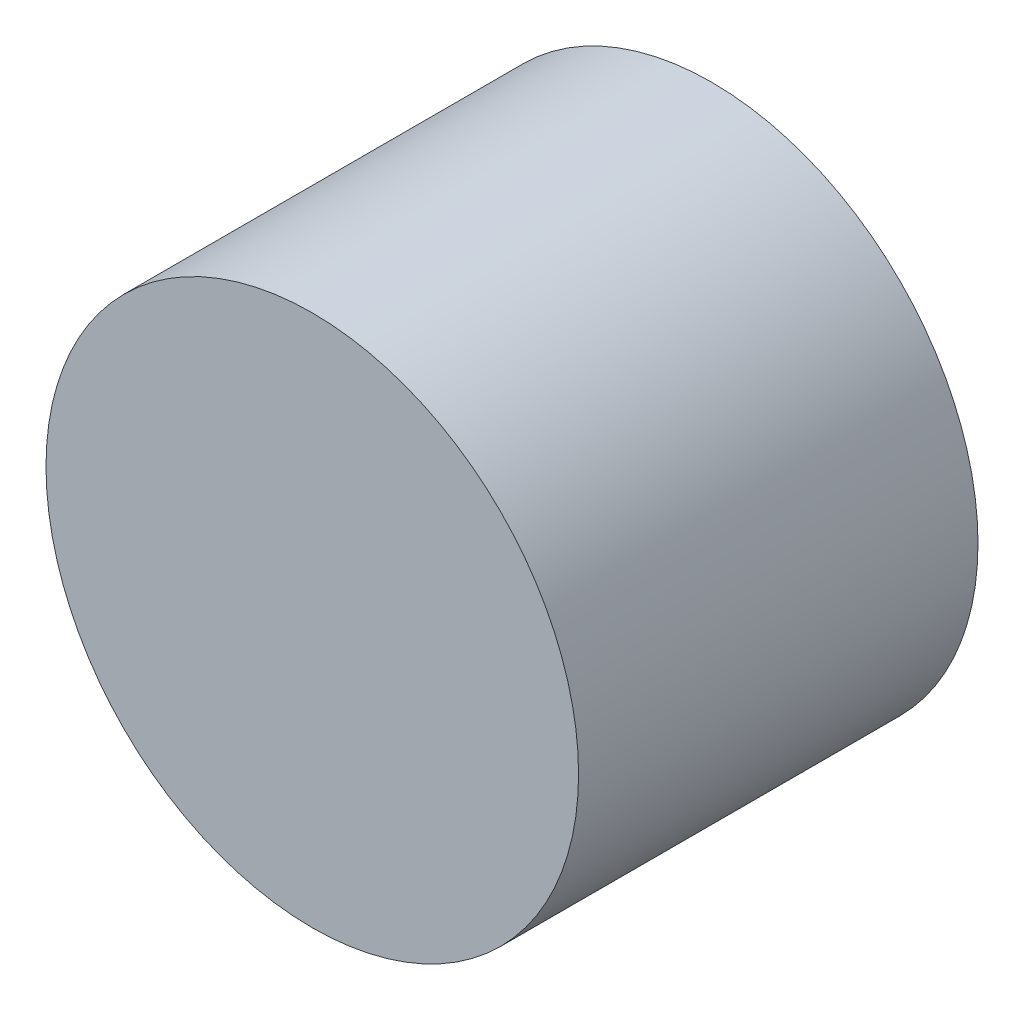
from build123d import *

# Parameters (mm, degrees)
SKETCH1_R           = 30
BOSS_EXTRUDE1_DEPTH = 45


with BuildPart() as part:
    # Sketch1 → Boss-Extrude1 (new body)
    with BuildSketch(Plane.XY):
        with Locations(Location((0, 0, 0), (0, 0, 180))):
            Circle(SKETCH1_R)
    extrude(amount=BOSS_EXTRUDE1_DEPTH)


solid = part.part
